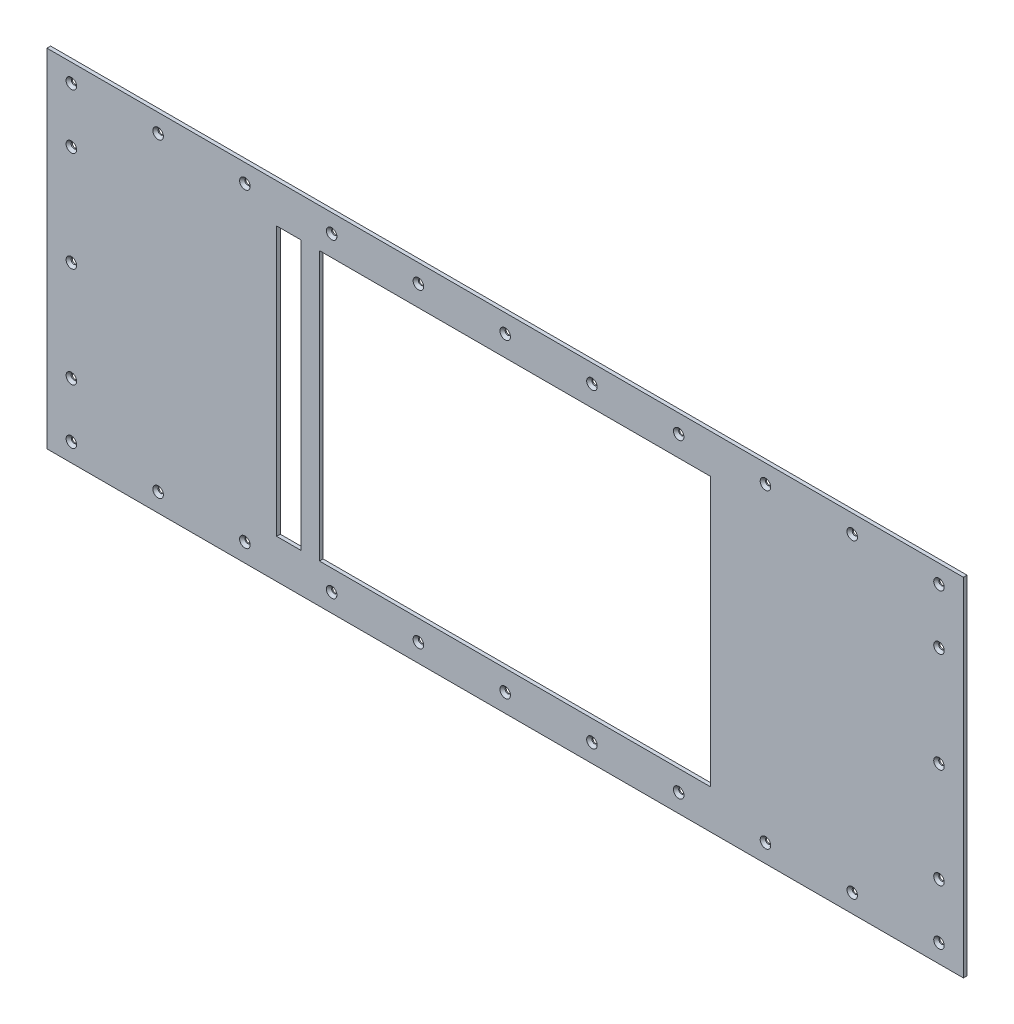
from build123d import *

# Parameters (mm, degrees)
SKETCH_1_W                  = 750
SKETCH_1_H                  = 284
SKETCH_1_W_2                = 320
SKETCH_1_H_2                = 220
SKETCH_1_W_3                = 20
EXTRUDE_1_DEPTH             = 3
HOLE_WIZARD_M41_AT_2_COUNT  = 2
HOLE_WIZARD_M41_AT_2_PITCH  = 254
HOLE_WIZARD_M41_AT_3_COUNT  = 2
HOLE_WIZARD_M41_AT_3_PITCH  = 71
HOLE_WIZARD_M41_AT_4_COUNT  = 2
HOLE_WIZARD_M41_AT_4_PITCH  = 263.736611035
HOLE_WIZARD_M41_AT_5_COUNT  = 2
HOLE_WIZARD_M41_AT_5_PITCH  = 142
HOLE_WIZARD_M41_AT_6_COUNT  = 2
HOLE_WIZARD_M41_AT_6_PITCH  = 290.998281782
HOLE_WIZARD_M41_AT_7_COUNT  = 2
HOLE_WIZARD_M41_AT_7_PITCH  = 213
HOLE_WIZARD_M41_AT_8_COUNT  = 2
HOLE_WIZARD_M41_AT_8_PITCH  = 331.489064676
HOLE_WIZARD_M41_AT_9_COUNT  = 2
HOLE_WIZARD_M41_AT_9_PITCH  = 284
HOLE_WIZARD_M41_AT_10_COUNT = 2
HOLE_WIZARD_M41_AT_10_PITCH = 381.014435422
HOLE_WIZARD_M41_AT_11_COUNT = 2
HOLE_WIZARD_M41_AT_11_PITCH = 355
HOLE_WIZARD_M41_AT_12_COUNT = 2
HOLE_WIZARD_M41_AT_12_PITCH = 436.510022794
HOLE_WIZARD_M41_AT_13_COUNT = 2
HOLE_WIZARD_M41_AT_13_PITCH = 426
HOLE_WIZARD_M41_AT_14_COUNT = 2
HOLE_WIZARD_M41_AT_14_PITCH = 495.975805862
HOLE_WIZARD_M41_AT_15_COUNT = 2
HOLE_WIZARD_M41_AT_15_PITCH = 497
HOLE_WIZARD_M41_AT_16_COUNT = 2
HOLE_WIZARD_M41_AT_16_PITCH = 558.144246589
HOLE_WIZARD_M41_AT_17_COUNT = 2
HOLE_WIZARD_M41_AT_17_PITCH = 568
HOLE_WIZARD_M41_AT_18_COUNT = 2
HOLE_WIZARD_M41_AT_18_PITCH = 622.20575375
HOLE_WIZARD_M41_AT_19_COUNT = 2
HOLE_WIZARD_M41_AT_19_PITCH = 639
HOLE_WIZARD_M41_AT_20_COUNT = 2
HOLE_WIZARD_M41_AT_20_PITCH = 687.63144198
HOLE_WIZARD_M41_AT_21_COUNT = 2
HOLE_WIZARD_M41_AT_21_PITCH = 710
HOLE_WIZARD_M41_AT_22_COUNT = 2
HOLE_WIZARD_M41_AT_22_PITCH = 754.066310082
HOLE_WIZARD_M42_AT_2_COUNT  = 2
HOLE_WIZARD_M42_AT_2_PITCH  = 710
HOLE_WIZARD_M42_AT_3_COUNT  = 2
HOLE_WIZARD_M42_AT_3_PITCH  = 82
HOLE_WIZARD_M42_AT_4_COUNT  = 2
HOLE_WIZARD_M42_AT_4_PITCH  = 714.719525408
HOLE_WIZARD_M42_AT_5_COUNT  = 2
HOLE_WIZARD_M42_AT_5_PITCH  = 164
HOLE_WIZARD_M42_AT_6_COUNT  = 2
HOLE_WIZARD_M42_AT_6_PITCH  = 728.694723461


with BuildPart() as part:
    # Эскиз1 → Бобышка-Вытянуть1 (new body)
    with BuildSketch(Plane.XY):
        with Locations((375, 142)):
            Rectangle(SKETCH_1_W, SKETCH_1_H)
        with Locations((383, 142)):
            Rectangle(SKETCH_1_W_2, SKETCH_1_H_2, mode=Mode.SUBTRACT)
        with Locations((198, 142)):
            Rectangle(SKETCH_1_W_3, SKETCH_1_H_2, mode=Mode.SUBTRACT)
    extrude(amount=EXTRUDE_1_DEPTH)

    # Эскиз2 → Зенковка для винта с полупотайной головкой M41 (revolve, cut)
    with BuildSketch(Plane(origin=(20, 15, 3), x_dir=(0, -1, 0), z_dir=(1, 0, 0))):
        Polygon((0, 0), (0, 3), (2.15, 3), (2.15, 2.15), (4.3, 0), align=None)
    hole_wizard_m41 = revolve(axis=Axis((20, 15, 9.35), (0, 0, -1)), mode=Mode.SUBTRACT)

    # Зенковка для винта с полупотайной головкой M41 at 2: Зенковка для винта с полупотайной головкой M41 ×2
    with Locations(*[(0, i * HOLE_WIZARD_M41_AT_2_PITCH, 0) for i in range(1, HOLE_WIZARD_M41_AT_2_COUNT)]):
        add(hole_wizard_m41, mode=Mode.SUBTRACT)

    # Зенковка для винта с полупотайной головкой M41 at 3: Зенковка для винта с полупотайной головкой M41 ×2
    with Locations(*[(i * HOLE_WIZARD_M41_AT_3_PITCH, 0, 0) for i in range(1, HOLE_WIZARD_M41_AT_3_COUNT)]):
        add(hole_wizard_m41, mode=Mode.SUBTRACT)

    # Зенковка для винта с полупотайной головкой M41 at 4: Зенковка для винта с полупотайной головкой M41 ×2
    with Locations(*[Vector(0.2692079788296573, 0.9630820651089143, 0) * (i * HOLE_WIZARD_M41_AT_4_PITCH) for i in range(1, HOLE_WIZARD_M41_AT_4_COUNT)]):
        add(hole_wizard_m41, mode=Mode.SUBTRACT)

    # Зенковка для винта с полупотайной головкой M41 at 5: Зенковка для винта с полупотайной головкой M41 ×2
    with Locations(*[(i * HOLE_WIZARD_M41_AT_5_PITCH, 0, 0) for i in range(1, HOLE_WIZARD_M41_AT_5_COUNT)]):
        add(hole_wizard_m41, mode=Mode.SUBTRACT)

    # Зенковка для винта с полупотайной головкой M41 at 6: Зенковка для винта с полупотайной головкой M41 ×2
    with Locations(*[Vector(0.4879753898562281, 0.8728573874893093, 0) * (i * HOLE_WIZARD_M41_AT_6_PITCH) for i in range(1, HOLE_WIZARD_M41_AT_6_COUNT)]):
        add(hole_wizard_m41, mode=Mode.SUBTRACT)

    # Зенковка для винта с полупотайной головкой M41 at 7: Зенковка для винта с полупотайной головкой M41 ×2
    with Locations(*[(i * HOLE_WIZARD_M41_AT_7_PITCH, 0, 0) for i in range(1, HOLE_WIZARD_M41_AT_7_COUNT)]):
        add(hole_wizard_m41, mode=Mode.SUBTRACT)

    # Зенковка для винта с полупотайной головкой M41 at 8: Зенковка для винта с полупотайной головкой M41 ×2
    with Locations(*[Vector(0.6425551328758441, 0.7662394542275323, 0) * (i * HOLE_WIZARD_M41_AT_8_PITCH) for i in range(1, HOLE_WIZARD_M41_AT_8_COUNT)]):
        add(hole_wizard_m41, mode=Mode.SUBTRACT)

    # Зенковка для винта с полупотайной головкой M41 at 9: Зенковка для винта с полупотайной головкой M41 ×2
    with Locations(*[(i * HOLE_WIZARD_M41_AT_9_PITCH, 0, 0) for i in range(1, HOLE_WIZARD_M41_AT_9_COUNT)]):
        add(hole_wizard_m41, mode=Mode.SUBTRACT)

    # Зенковка для винта с полупотайной головкой M41 at 10: Зенковка для винта с полупотайной головкой M41 ×2
    with Locations(*[Vector(0.7453785830591875, 0.6666414087923718, 0) * (i * HOLE_WIZARD_M41_AT_10_PITCH) for i in range(1, HOLE_WIZARD_M41_AT_10_COUNT)]):
        add(hole_wizard_m41, mode=Mode.SUBTRACT)

    # Зенковка для винта с полупотайной головкой M41 at 11: Зенковка для винта с полупотайной головкой M41 ×2
    with Locations(*[(i * HOLE_WIZARD_M41_AT_11_PITCH, 0, 0) for i in range(1, HOLE_WIZARD_M41_AT_11_COUNT)]):
        add(hole_wizard_m41, mode=Mode.SUBTRACT)

    # Зенковка для винта с полупотайной головкой M41 at 12: Зенковка для винта с полупотайной головкой M41 ×2
    with Locations(*[Vector(0.8132688402602337, 0.5818881279608432, 0) * (i * HOLE_WIZARD_M41_AT_12_PITCH) for i in range(1, HOLE_WIZARD_M41_AT_12_COUNT)]):
        add(hole_wizard_m41, mode=Mode.SUBTRACT)

    # Зенковка для винта с полупотайной головкой M41 at 13: Зенковка для винта с полупотайной головкой M41 ×2
    with Locations(*[(i * HOLE_WIZARD_M41_AT_13_PITCH, 0, 0) for i in range(1, HOLE_WIZARD_M41_AT_13_COUNT)]):
        add(hole_wizard_m41, mode=Mode.SUBTRACT)

    # Зенковка для винта с полупотайной головкой M41 at 14: Зенковка для винта с полупотайной головкой M41 ×2
    with Locations(*[Vector(0.8589128642273502, 0.5121217547271055, 0) * (i * HOLE_WIZARD_M41_AT_14_PITCH) for i in range(1, HOLE_WIZARD_M41_AT_14_COUNT)]):
        add(hole_wizard_m41, mode=Mode.SUBTRACT)

    # Зенковка для винта с полупотайной головкой M41 at 15: Зенковка для винта с полупотайной головкой M41 ×2
    with Locations(*[(i * HOLE_WIZARD_M41_AT_15_PITCH, 0, 0) for i in range(1, HOLE_WIZARD_M41_AT_15_COUNT)]):
        add(hole_wizard_m41, mode=Mode.SUBTRACT)

    # Зенковка для винта с полупотайной головкой M41 at 16: Зенковка для винта с полупотайной головкой M41 ×2
    with Locations(*[Vector(0.8904508163214954, 0.4550794916411667, 0) * (i * HOLE_WIZARD_M41_AT_16_PITCH) for i in range(1, HOLE_WIZARD_M41_AT_16_COUNT)]):
        add(hole_wizard_m41, mode=Mode.SUBTRACT)

    # Зенковка для винта с полупотайной головкой M41 at 17: Зенковка для винта с полупотайной головкой M41 ×2
    with Locations(*[(i * HOLE_WIZARD_M41_AT_17_PITCH, 0, 0) for i in range(1, HOLE_WIZARD_M41_AT_17_COUNT)]):
        add(hole_wizard_m41, mode=Mode.SUBTRACT)

    # Зенковка для винта с полупотайной головкой M41 at 18: Зенковка для винта с полупотайной головкой M41 ×2
    with Locations(*[Vector(0.912881304257323, 0.4082250902840845, 0) * (i * HOLE_WIZARD_M41_AT_18_PITCH) for i in range(1, HOLE_WIZARD_M41_AT_18_COUNT)]):
        add(hole_wizard_m41, mode=Mode.SUBTRACT)

    # Зенковка для винта с полупотайной головкой M41 at 19: Зенковка для винта с полупотайной головкой M41 ×2
    with Locations(*[(i * HOLE_WIZARD_M41_AT_19_PITCH, 0, 0) for i in range(1, HOLE_WIZARD_M41_AT_19_COUNT)]):
        add(hole_wizard_m41, mode=Mode.SUBTRACT)

    # Зенковка для винта с полупотайной головкой M41 at 20: Зенковка для винта с полупотайной головкой M41 ×2
    with Locations(*[Vector(0.9292768785553057, 0.36938392355719507, 0) * (i * HOLE_WIZARD_M41_AT_20_PITCH) for i in range(1, HOLE_WIZARD_M41_AT_20_COUNT)]):
        add(hole_wizard_m41, mode=Mode.SUBTRACT)

    # Зенковка для винта с полупотайной головкой M41 at 21: Зенковка для винта с полупотайной головкой M41 ×2
    with Locations(*[(i * HOLE_WIZARD_M41_AT_21_PITCH, 0, 0) for i in range(1, HOLE_WIZARD_M41_AT_21_COUNT)]):
        add(hole_wizard_m41, mode=Mode.SUBTRACT)

    # Зенковка для винта с полупотайной головкой M41 at 22: Зенковка для винта с полупотайной головкой M41 ×2
    with Locations(*[Vector(0.9415617572454846, 0.3368404032962719, 0) * (i * HOLE_WIZARD_M41_AT_22_PITCH) for i in range(1, HOLE_WIZARD_M41_AT_22_COUNT)]):
        add(hole_wizard_m41, mode=Mode.SUBTRACT)

    # Эскиз4 → Зенковка для винта с полупотайной головкой M42 (revolve, cut)
    with BuildSketch(Plane(origin=(20, 224, 3), x_dir=(0, -1, 0), z_dir=(1, 0, 0))):
        Polygon((0, 0), (0, 3), (2.25, 3), (2.25, 2.05), (4.3, 0), align=None)
    hole_wizard_m42 = revolve(axis=Axis((20, 224, 9.35), (0, 0, -1)), mode=Mode.SUBTRACT)

    # Зенковка для винта с полупотайной головкой M42 at 2: Зенковка для винта с полупотайной головкой M42 ×2
    with Locations(*[(i * HOLE_WIZARD_M42_AT_2_PITCH, 0, 0) for i in range(1, HOLE_WIZARD_M42_AT_2_COUNT)]):
        add(hole_wizard_m42, mode=Mode.SUBTRACT)

    # Зенковка для винта с полупотайной головкой M42 at 3: Зенковка для винта с полупотайной головкой M42 ×2
    with Locations(*[(0, -i * HOLE_WIZARD_M42_AT_3_PITCH, 0) for i in range(1, HOLE_WIZARD_M42_AT_3_COUNT)]):
        add(hole_wizard_m42, mode=Mode.SUBTRACT)

    # Зенковка для винта с полупотайной головкой M42 at 4: Зенковка для винта с полупотайной головкой M42 ×2
    with Locations(*[Vector(0.9933966748624963, -0.11473032019538675, 0) * (i * HOLE_WIZARD_M42_AT_4_PITCH) for i in range(1, HOLE_WIZARD_M42_AT_4_COUNT)]):
        add(hole_wizard_m42, mode=Mode.SUBTRACT)

    # Зенковка для винта с полупотайной головкой M42 at 5: Зенковка для винта с полупотайной головкой M42 ×2
    with Locations(*[(0, -i * HOLE_WIZARD_M42_AT_5_PITCH, 0) for i in range(1, HOLE_WIZARD_M42_AT_5_COUNT)]):
        add(hole_wizard_m42, mode=Mode.SUBTRACT)

    # Зенковка для винта с полупотайной головкой M42 at 6: Зенковка для винта с полупотайной головкой M42 ×2
    with Locations(*[Vector(0.9743449172072053, -0.22505995270701593, 0) * (i * HOLE_WIZARD_M42_AT_6_PITCH) for i in range(1, HOLE_WIZARD_M42_AT_6_COUNT)]):
        add(hole_wizard_m42, mode=Mode.SUBTRACT)


solid = part.part
